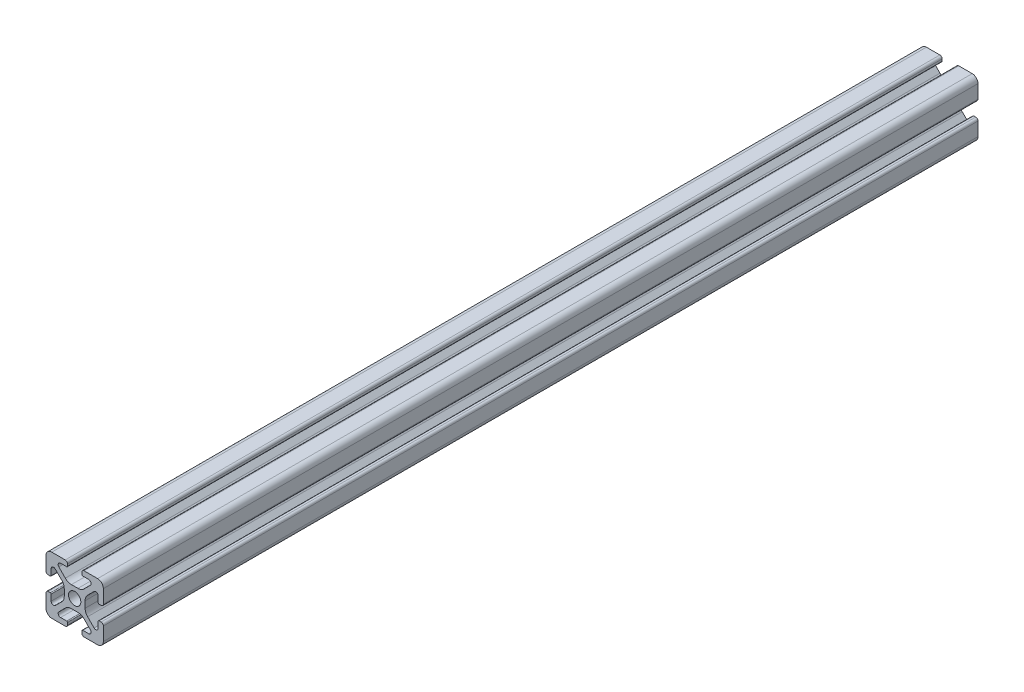
from build123d import *

# Parameters (mm, degrees)
SKETCH1_R           = 2.1463
BOSS_EXTRUDE1_DEPTH = 152.4


with BuildPart() as part:
    # Sketch1 → Boss-Extrude1 (new, symmetric)
    with BuildSketch(Plane.XY):
        with BuildLine():
            Line((-9.9949, 7.9883), (-9.9949, 3.2893))
            ThreePointArc((-9.9949, 3.2893), (-9.76427588, 2.73252412), (-9.2075, 2.5019))
            Line((-9.2075, 2.5019), (-8.4963, 2.5019))
            ThreePointArc((-8.4963, 2.5019), (-8.280773853, 2.591173853), (-8.1915, 2.8067))
            Line((-8.1915, 2.8067), (-8.1915, 4.9149))
            ThreePointArc((-8.1915, 4.9149), (-7.674065253, 5.689295824), (-6.760603096, 5.507596904))
            Line((-6.760603096, 5.507596904), (-4.505765747, 3.252759555))
            ThreePointArc((-4.505765747, 3.252759555), (-3.856054457, 2.280397894), (-3.627906192, 1.133419111))
            Line((-3.627906192, 1.133419111), (-3.627906192, -1.133419111))
            ThreePointArc((-3.627906192, -1.133419111), (-3.856054457, -2.280397894), (-4.505765747, -3.252759555))
            Line((-4.505765747, -3.252759555), (-6.760603096, -5.507596904))
            ThreePointArc((-6.760603096, -5.507596904), (-7.674065253, -5.689295824), (-8.1915, -4.9149))
            Line((-8.1915, -4.9149), (-8.1915, -2.8067))
            ThreePointArc((-8.1915, -2.8067), (-8.280773853, -2.591173853), (-8.4963, -2.5019))
            Line((-8.4963, -2.5019), (-9.2075, -2.5019))
            ThreePointArc((-9.2075, -2.5019), (-9.76427588, -2.73252412), (-9.9949, -3.2893))
            Line((-9.9949, -3.2893), (-9.9949, -7.9883))
            ThreePointArc((-9.9949, -7.9883), (-9.407180467, -9.407180467), (-7.9883, -9.9949))
            Line((-7.9883, -9.9949), (-3.2893, -9.9949))
            ThreePointArc((-3.2893, -9.9949), (-2.73252412, -9.76427588), (-2.5019, -9.2075))
            Line((-2.5019, -9.2075), (-2.5019, -8.4963))
            ThreePointArc((-2.5019, -8.4963), (-2.591173853, -8.280773853), (-2.8067, -8.1915))
            Line((-2.8067, -8.1915), (-4.9149, -8.1915))
            ThreePointArc((-4.9149, -8.1915), (-5.689295824, -7.674065253), (-5.507596904, -6.760603096))
            Line((-5.507596904, -6.760603096), (-3.252759555, -4.505765747))
            ThreePointArc((-3.252759555, -4.505765747), (-2.280397894, -3.856054457), (-1.133419111, -3.627906192))
            Line((-1.133419111, -3.627906192), (1.133419111, -3.627906192))
            ThreePointArc((1.133419111, -3.627906192), (2.280397894, -3.856054457), (3.252759555, -4.505765747))
            Line((3.252759555, -4.505765747), (5.507596904, -6.760603096))
            ThreePointArc((5.507596904, -6.760603096), (5.689295824, -7.674065253), (4.9149, -8.1915))
            Line((4.9149, -8.1915), (2.8067, -8.1915))
            ThreePointArc((2.8067, -8.1915), (2.591173853, -8.280773853), (2.5019, -8.4963))
            Line((2.5019, -8.4963), (2.5019, -9.2075))
            ThreePointArc((2.5019, -9.2075), (2.73252412, -9.76427588), (3.2893, -9.9949))
            Line((3.2893, -9.9949), (7.9883, -9.9949))
            ThreePointArc((7.9883, -9.9949), (9.407180467, -9.407180467), (9.9949, -7.9883))
            Line((9.9949, -7.9883), (9.9949, -3.2893))
            ThreePointArc((9.9949, -3.2893), (9.76427588, -2.73252412), (9.2075, -2.5019))
            Line((9.2075, -2.5019), (8.4963, -2.5019))
            ThreePointArc((8.4963, -2.5019), (8.280773853, -2.591173853), (8.1915, -2.8067))
            Line((8.1915, -2.8067), (8.1915, -4.9149))
            ThreePointArc((8.1915, -4.9149), (7.674065253, -5.689295824), (6.760603096, -5.507596904))
            Line((6.760603096, -5.507596904), (4.505765747, -3.252759555))
            ThreePointArc((4.505765747, -3.252759555), (3.856054457, -2.280397894), (3.627906192, -1.133419111))
            Line((3.627906192, -1.133419111), (3.627906192, 1.133419111))
            ThreePointArc((3.627906192, 1.133419111), (3.856054457, 2.280397894), (4.505765747, 3.252759555))
            Line((4.505765747, 3.252759555), (6.760603096, 5.507596904))
            ThreePointArc((6.760603096, 5.507596904), (7.674065253, 5.689295824), (8.1915, 4.9149))
            Line((8.1915, 4.9149), (8.1915, 2.8067))
            ThreePointArc((8.1915, 2.8067), (8.280773853, 2.591173853), (8.4963, 2.5019))
            Line((8.4963, 2.5019), (9.2075, 2.5019))
            ThreePointArc((9.2075, 2.5019), (9.76427588, 2.73252412), (9.9949, 3.2893))
            Line((9.9949, 3.2893), (9.9949, 7.9883))
            ThreePointArc((9.9949, 7.9883), (9.407180467, 9.407180467), (7.9883, 9.9949))
            Line((7.9883, 9.9949), (3.2893, 9.9949))
            ThreePointArc((3.2893, 9.9949), (2.73252412, 9.76427588), (2.5019, 9.2075))
            Line((2.5019, 9.2075), (2.5019, 8.4963))
            ThreePointArc((2.5019, 8.4963), (2.591173853, 8.280773853), (2.8067, 8.1915))
            Line((2.8067, 8.1915), (4.9149, 8.1915))
            ThreePointArc((4.9149, 8.1915), (5.689295824, 7.674065253), (5.507596904, 6.760603096))
            Line((5.507596904, 6.760603096), (3.252759555, 4.505765747))
            ThreePointArc((3.252759555, 4.505765747), (2.280397894, 3.856054457), (1.133419111, 3.627906192))
            Line((1.133419111, 3.627906192), (-1.133419111, 3.627906192))
            ThreePointArc((-1.133419111, 3.627906192), (-2.280397894, 3.856054457), (-3.252759555, 4.505765747))
            Line((-3.252759555, 4.505765747), (-5.507596904, 6.760603096))
            ThreePointArc((-5.507596904, 6.760603096), (-5.689295824, 7.674065253), (-4.9149, 8.1915))
            Line((-4.9149, 8.1915), (-2.8067, 8.1915))
            ThreePointArc((-2.8067, 8.1915), (-2.591173853, 8.280773853), (-2.5019, 8.4963))
            Line((-2.5019, 8.4963), (-2.5019, 9.2075))
            ThreePointArc((-2.5019, 9.2075), (-2.73252412, 9.76427588), (-3.2893, 9.9949))
            Line((-3.2893, 9.9949), (-7.9883, 9.9949))
            ThreePointArc((-7.9883, 9.9949), (-9.407180467, 9.407180467), (-9.9949, 7.9883))
        make_face()
        Circle(SKETCH1_R, mode=Mode.SUBTRACT)
    extrude(amount=BOSS_EXTRUDE1_DEPTH, both=True)


solid = part.part
